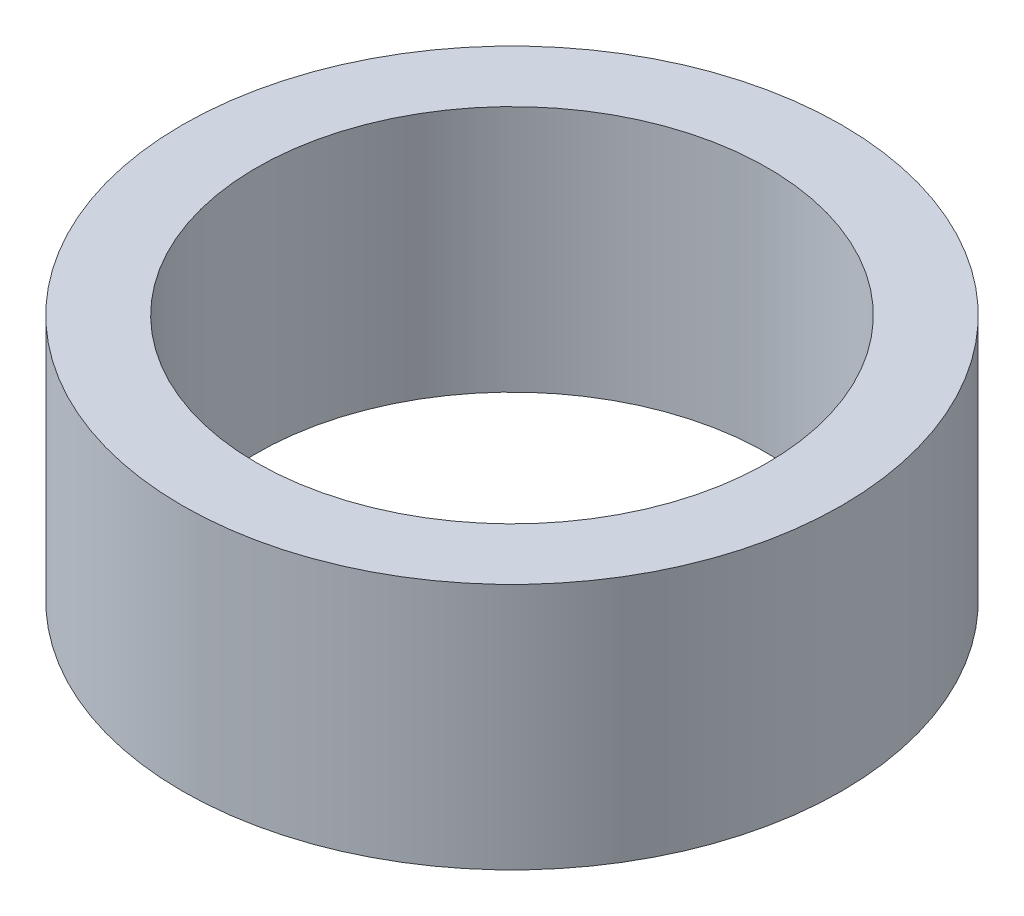
from build123d import *

# Parameters (mm, degrees)
SKETCH1_R           = 4
SKETCH1_R_2         = 3.1
BOSS_EXTRUDE1_DEPTH = 3


with BuildPart() as part:
    # Sketch1 → Boss-Extrude1 (new body)
    with BuildSketch(Plane(origin=(0, 0, 0), x_dir=(1, 0, 0), z_dir=(0, 1, 0))):
        with Locations(Location((0, 0, 0), (0, 0, 270))):
            Circle(SKETCH1_R)
        with Locations(Location((0, 0, 0), (0, 0, 270))):
            Circle(SKETCH1_R_2, mode=Mode.SUBTRACT)
    extrude(amount=BOSS_EXTRUDE1_DEPTH)


solid = part.part
